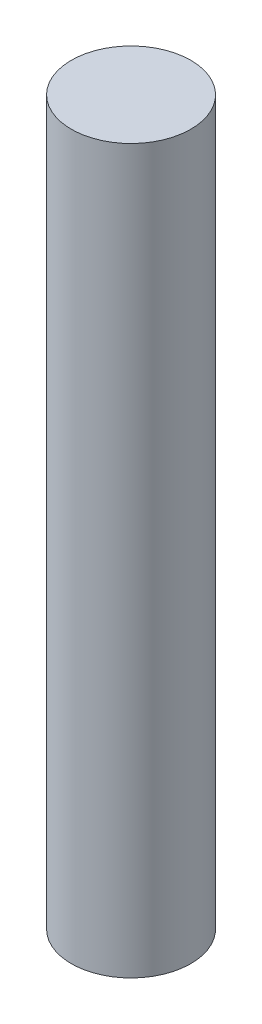
from build123d import *

# Parameters (mm, degrees)
SKETCH1_W = 1.5
SKETCH1_H = 18.14


with BuildPart() as part:
    # Sketch1 → Revolve1 (revolve)
    with BuildSketch(Plane.XY, mode=Mode.PRIVATE) as revolve1_sk:
        with Locations((0.75, 9.07)):
            Rectangle(SKETCH1_W, SKETCH1_H)
    revolve(revolve1_sk.sketch.rotate(Axis((0, 0, 0), (0, 1, 0)), 90), axis=Axis((0, 0, 0), (0, 1, 0)))


solid = part.part
